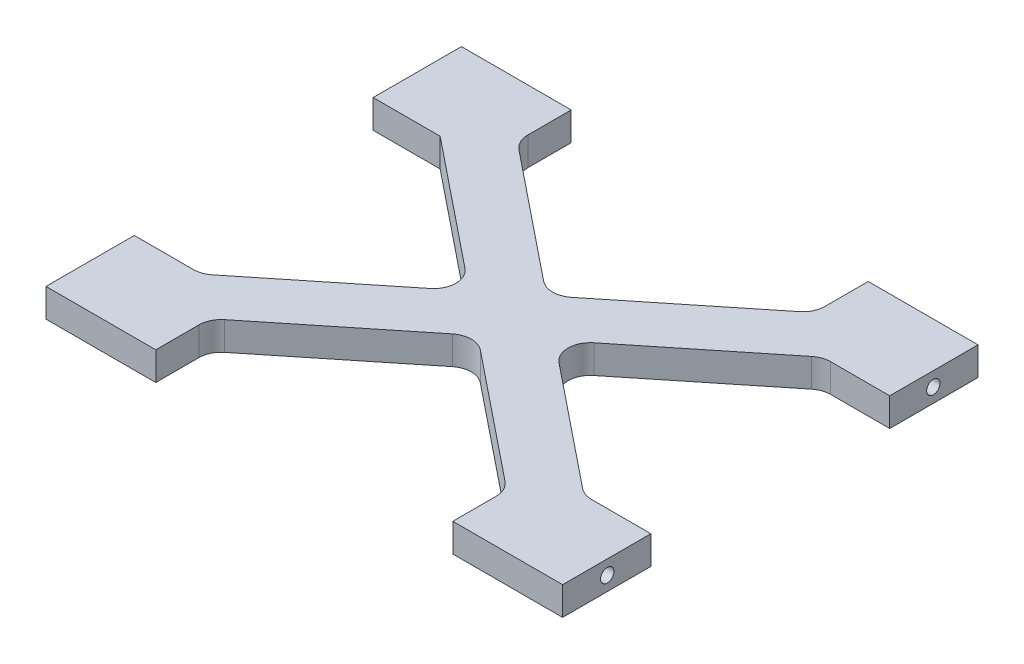
from build123d import *

# Parameters (mm, degrees)
BOSS_EXTRUDE1_DEPTH = 6.35
FILLET1_R           = 5
SKETCH2_R           = 1.5
CUT_EXTRUDE1_DEPTH  = 20


with BuildPart() as part:
    # Sketch1 → Boss-Extrude1 (new body)
    with BuildSketch(Plane(origin=(0, 0, 0), x_dir=(1, 0, 0), z_dir=(0, 1, 0))):
        Polygon((-57.825, 26.738412941), (-42.825, 26.738412941), (-9.574489714, 0), (-42.825, -26.738412941), (-57.825, -26.738412941), (-57.825, -46.5), (-33.250510286, -46.5), (-33.250510286, -34.437743191), (0, -7.69933025), (33.250510286, -34.437743191), (33.250510286, -46.5), (57.825, -46.5), (57.825, -26.738412941), (42.825, -26.738412941), (9.574489714, 0), (42.825, 26.738412941), (57.825, 26.738412941), (57.825, 46.5), (33.250510286, 46.5), (33.250510286, 34.437743191), (0, 7.69933025), (-33.250510286, 34.437743191), (-33.250510286, 46.5), (-57.825, 46.5), align=None)
    extrude(amount=BOSS_EXTRUDE1_DEPTH)

    # Fillet1
    fillet1_edges = [part.edges().sort_by_distance(p)[0] for p in [
        (-33.250510286, 3.175, -34.437743191),
        (0, 3.175, -7.69933025),
        (33.250510286, 3.175, -34.437743191),
        (42.825, 3.175, -26.738412941),
        (9.574489714, 3.175, 0),
        (42.825, 3.175, 26.738412941),
        (33.250510286, 3.175, 34.437743191),
        (0, 3.175, 7.69933025),
        (-33.250510286, 3.175, 34.437743191),
        (-42.825, 3.175, 26.738412941),
        (-9.574489714, 3.175, 0),
    ]]
    fillet(fillet1_edges, radius=FILLET1_R)

    # Sketch2 → Cut-Extrude1 (cut)
    with BuildSketch(Plane(origin=(57.825, 0, 0), x_dir=(0, 0, -1), z_dir=(1, 0, 0))):
        with Locations((36.5, 3.175)):
            Circle(SKETCH2_R)
        with Locations(Location((-36.5, 3.175, 0), (0, 0, 180))):
            Circle(SKETCH2_R)
    cut_extrude1 = extrude(amount=-CUT_EXTRUDE1_DEPTH, mode=Mode.SUBTRACT)

    # Mirror1: Cut-Extrude1 across plane
    add(cut_extrude1.mirror(Plane(origin=(0, 0, 0), x_dir=(0, 0, 1), z_dir=(1, 0, 0))), mode=Mode.SUBTRACT)


solid = part.part
